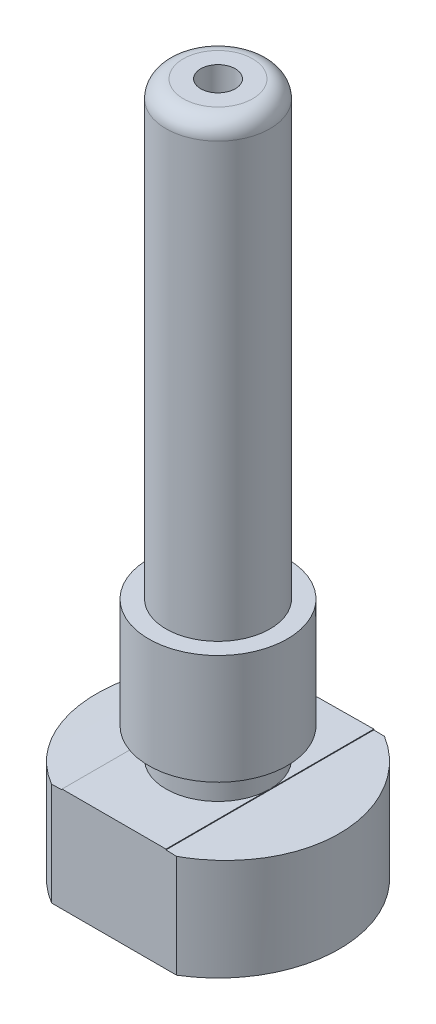
from build123d import *

# Parameters (mm, degrees)
SKETCH2_R                 = 0.5
CUT_EXTRUDE2_DEPTH        = 21.603397778
F_2_0MM_DOWEL_HOLE1_D     = 2
F_2_0MM_DOWEL_HOLE1_DEPTH = 2
F_2_0MM_DOWEL_HOLE1_TIP   = 0.600860619
CUT_EXTRUDE3_DEPTH        = 21.603397778
CUT_EXTRUDE4_DEPTH        = 5
CUT_EXTRUDE4_DEPTH_BACK   = 18
SCALE1_SCALE              = 1.2


with BuildPart() as part:
    # Sketch1 → Revolve2 (revolve)
    with BuildSketch(Plane.XY, mode=Mode.PRIVATE) as revolve2_sk:
        with BuildLine():
            Line((0, 0), (-3.5, 0))
            Line((-3.5, 0), (-3.5, 3))
            Line((-3.5, 3), (-1.5, 3))
            Line((-1.5, 3), (-1.5, 3.833209081))
            Line((-1.5, 3.833209081), (-2, 3.833209081))
            Line((-2, 3.833209081), (-2, 7))
            Line((-2, 7), (-1.5, 7))
            Line((-1.5, 7), (-1.5, 19.5))
            ThreePointArc((-1.5, 19.5), (-1.353553391, 19.853553391), (-1, 20))
            Line((-1, 20), (0, 20))
            Line((0, 20), (0, 0))
        make_face()
    revolve(revolve2_sk.sketch.rotate(Axis((0, 7, 0), (0, 1, 0)), 270), axis=Axis((0, 7, 0), (0, 1, 0)))

    # Sketch2 → Cut-Extrude2 (cut, through all)
    with BuildSketch(Plane(origin=(0, 20, 0), x_dir=(1, 0, 0), z_dir=(0, 1, 0))):
        with Locations(Location((0, 0, 0), (0, 0, 270))):
            Circle(SKETCH2_R)
    extrude(amount=-CUT_EXTRUDE2_DEPTH, mode=Mode.SUBTRACT)

    # Ø2.0mm Dowel Hole1
    with Locations(Plane(origin=(0, 0, 0), x_dir=(-1, 0, 0), z_dir=(0, -1, 0))):
        with Locations((0, 0)):
            Hole(F_2_0MM_DOWEL_HOLE1_D / 2, depth=F_2_0MM_DOWEL_HOLE1_DEPTH)
            with Locations((0, 0, -(F_2_0MM_DOWEL_HOLE1_DEPTH + F_2_0MM_DOWEL_HOLE1_TIP / 2))):  # 118° drill point
                Cone(0, F_2_0MM_DOWEL_HOLE1_D / 2, F_2_0MM_DOWEL_HOLE1_TIP, mode=Mode.SUBTRACT)

    # Sketch6 → Cut-Extrude3 (cut, through all)
    with BuildSketch(Plane(origin=(0, 20, 0), x_dir=(1, 0, 0), z_dir=(0, 1, 0))):
        with BuildLine():
            Line((1.802775638, -3), (-1.802775638, -3))
            ThreePointArc((-1.802775638, -3), (0, -3.5), (1.802775638, -3))
        make_face()
        with BuildLine():
            Line((-1.861759264, 2.963756475), (1.802775638, 3))
            ThreePointArc((1.802775638, 3), (-0.034614525, 3.499828829), (-1.861759264, 2.963756475))
        make_face()
    extrude(amount=-CUT_EXTRUDE3_DEPTH, mode=Mode.SUBTRACT)

    # Sketch7 → Cut-Extrude4 (cut, two sides: drawn at the far end of the back side and taken through both)
    with BuildSketch(Plane.XY.offset(-CUT_EXTRUDE4_DEPTH_BACK)):
        with BuildLine():
            Line((-4.156062939, 2.838931077), (-4.156062939, 3.239498592))
            Line((-4.156062939, 3.239498592), (-1.5, 3.239498592))
            Line((-1.5, 3.239498592), (-1.5, 2.979046191))
            ThreePointArc((-1.5, 2.979046191), (-2.828899089, 2.925435476), (-4.156062939, 2.838931077))
        make_face()
        with BuildLine():
            Line((4.156062939, 3.239498592), (1.5, 3.239498592))
            Line((1.5, 3.239498592), (1.5, 2.979046191))
            ThreePointArc((1.5, 2.979046191), (2.828899089, 2.925435476), (4.156062939, 2.838931077))
            Line((4.156062939, 2.838931077), (4.156062939, 3.239498592))
        make_face()
    extrude(amount=CUT_EXTRUDE4_DEPTH + CUT_EXTRUDE4_DEPTH_BACK, mode=Mode.SUBTRACT)


with BuildPart() as part_1:
    # Scale1: scaled about (0.000542722, 6.55250098, 0.00261842)
    add(part.part.scale(SCALE1_SCALE).moved(Location((-0.000108544, -1.310500196, -0.000523684))))


solid = part_1.part
